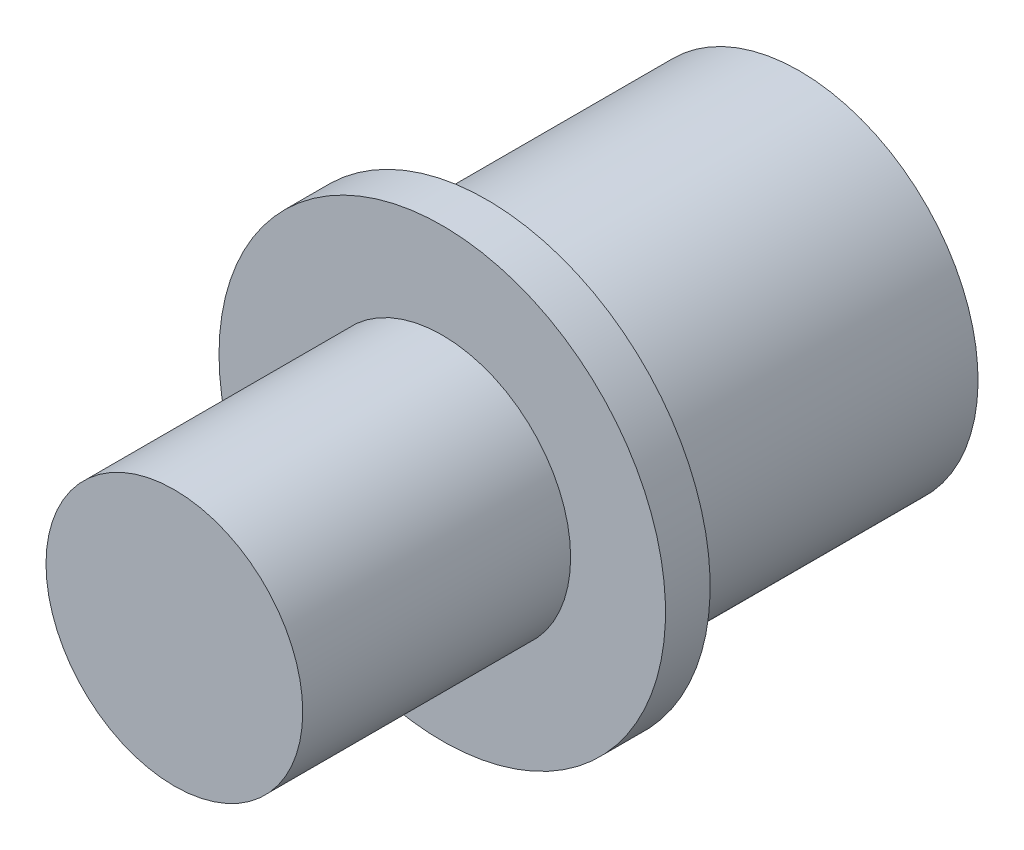
from build123d import *

# Parameters (mm, degrees)
SKETCH13_R          = 5
BOSS_EXTRUDE5_DEPTH = 1
SKETCH14_R          = 4
BOSS_EXTRUDE6_DEPTH = 7
SKETCH15_R          = 2.5
CUT_EXTRUDE5_DEPTH  = 3
SKETCH16_R          = 2.875
BOSS_EXTRUDE7_DEPTH = 6


with BuildPart() as part:
    # Sketch13 → Boss-Extrude5 (new body)
    with BuildSketch(Plane(origin=(0, 5, 0), x_dir=(1, 0, 0), z_dir=(0, 0, -1))):
        with Locations(Location((0, 5, 0), (0, 0, 180))):
            Circle(SKETCH13_R)
    extrude(amount=BOSS_EXTRUDE5_DEPTH)

    # Sketch14 → Boss-Extrude6 (add)
    with BuildSketch(Plane(origin=(0, 0, -1), x_dir=(1, 0, 0), z_dir=(0, 0, -1))):
        with Locations(Location((0, 0, 0), (0, 0, 270))):
            Circle(SKETCH14_R)
    extrude(amount=BOSS_EXTRUDE6_DEPTH)

    # Sketch15 → Cut-Extrude5 (cut)
    with BuildSketch(Plane(origin=(0, 0, -8), x_dir=(1, 0, 0), z_dir=(0, 0, -1))):
        with Locations(Location((0, 0, 0), (0, 0, 270))):
            Circle(SKETCH15_R)
    extrude(amount=-CUT_EXTRUDE5_DEPTH, mode=Mode.SUBTRACT)

    # Sketch16 → Boss-Extrude7 (add)
    with BuildSketch(Plane.XY):
        Circle(SKETCH16_R)
    extrude(amount=BOSS_EXTRUDE7_DEPTH)


solid = part.part
